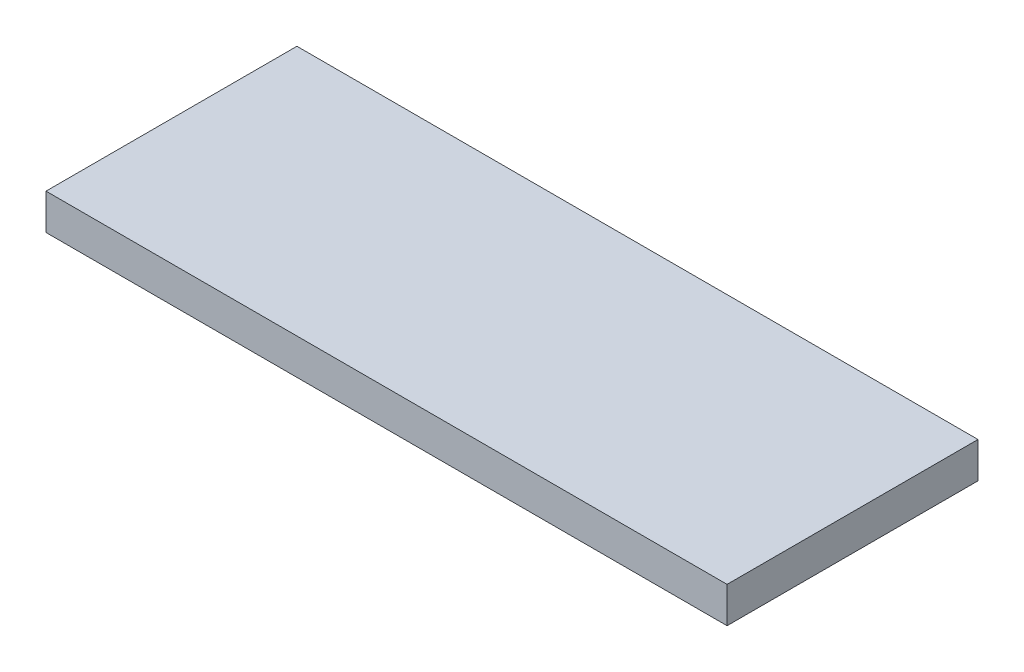
from build123d import *

# Parameters (mm, degrees)
SKIZZE1_W                       = 350
SKIZZE1_H                       = 50
AUFSATZ_LINEAR_AUSTRAGEN1_DEPTH = 950


with BuildPart() as part:
    # Skizze1 → Aufsatz-Linear austragen1 (new body)
    with BuildSketch(Plane(origin=(0, 0, 0), x_dir=(0, 0, -1), z_dir=(1, 0, 0))):
        with Locations((175, 25)):
            Rectangle(SKIZZE1_W, SKIZZE1_H)
    extrude(amount=AUFSATZ_LINEAR_AUSTRAGEN1_DEPTH)


solid = part.part
